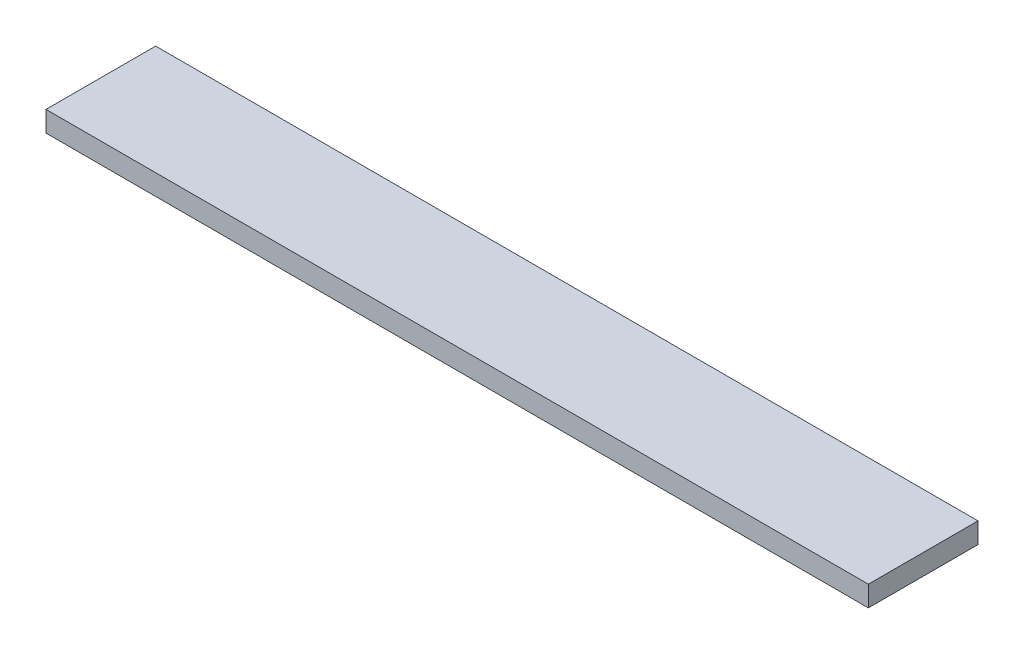
from build123d import *

# Parameters (mm, degrees)
CROQUIS1_W              = 1524
CROQUIS1_H              = 203.2
SALIENTE_EXTRUIR1_DEPTH = 38.1


with BuildPart() as part:
    # Croquis1 → Saliente-Extruir1 (new body)
    with BuildSketch(Plane(origin=(0, 0, 0), x_dir=(1, 0, 0), z_dir=(0, 1, 0))):
        Rectangle(CROQUIS1_W, CROQUIS1_H)
    extrude(amount=SALIENTE_EXTRUIR1_DEPTH)


solid = part.part
